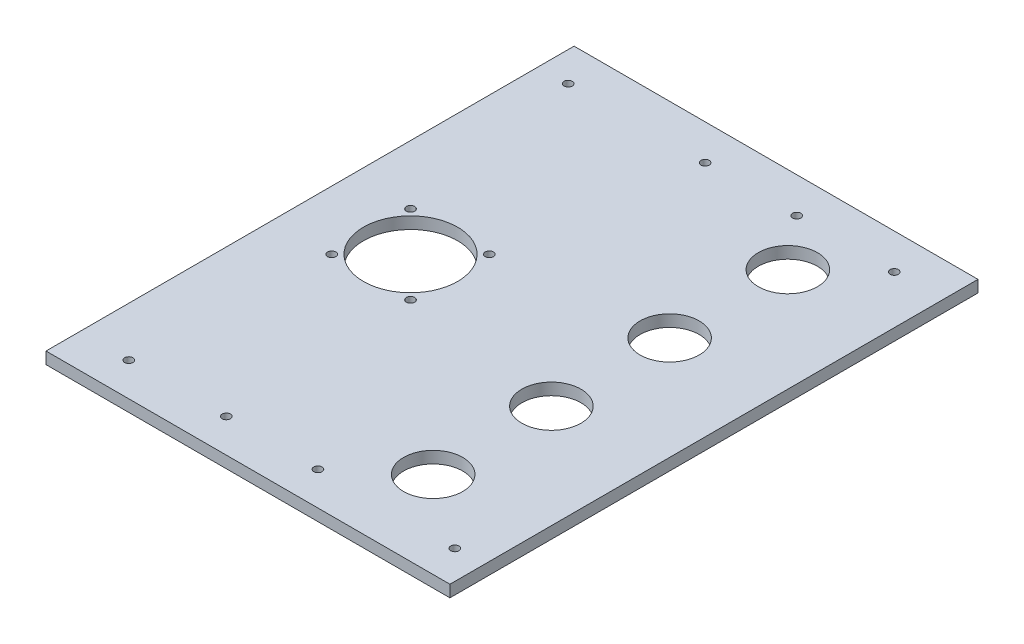
from build123d import *

# Parameters (mm, degrees)
ESBO_O1_W                    = 205
ESBO_O1_H                    = 268
RESSALTO_EXTRUS_O1_DEPTH     = 6
ESBO_O3_R                    = 23.9
ESBO_O3_R_2                  = 2.1
CORTE_EXTRUS_O4_DEPTH        = 169.814247029
ESBO_O4_R                    = 15
CORTE_EXTRUS_O5_DEPTH        = 169.814247029
FURO_DE_DI_METRO_4_2_4_2_1_D = 4.2


with BuildPart() as part:
    # Esboço1 → Ressalto-extrusão1 (new body)
    with BuildSketch(Plane.XZ):
        Rectangle(ESBO_O1_W, ESBO_O1_H)
    extrude(amount=-RESSALTO_EXTRUS_O1_DEPTH)

    # Esboço3 → Corte-extrusão4 (cut, through all)
    with BuildSketch(Plane(origin=(0, 6, 0), x_dir=(1, 0, 0), z_dir=(0, 1, 0))):
        with Locations(Location((-52.5, 1, 0), (0, 0, 270))):
            Circle(ESBO_O3_R)
        with Locations(Location((-72.5, 21, 0), (0, 0, 270))):
            Circle(ESBO_O3_R_2)
        with Locations(Location((-32.5, 21, 0), (0, 0, 270))):
            Circle(ESBO_O3_R_2)
        with Locations(Location((-32.5, -19, 0), (0, 0, 270))):
            Circle(ESBO_O3_R_2)
        with Locations(Location((-72.5, -19, 0), (0, 0, 270))):
            Circle(ESBO_O3_R_2)
    extrude(amount=-CORTE_EXTRUS_O4_DEPTH, mode=Mode.SUBTRACT)

    # Esboço4 → Corte-extrusão5 (cut, through all)
    with BuildSketch(Plane(origin=(0, 6, 0), x_dir=(1, 0, 0), z_dir=(0, 1, 0))):
        with Locations(Location((50, 30, 0), (0, 0, 270))):
            Circle(ESBO_O4_R)
        with Locations(Location((50, -30, 0), (0, 0, 270))):
            Circle(ESBO_O4_R)
        with Locations(Location((50, 90, 0), (0, 0, 270))):
            Circle(ESBO_O4_R)
        with Locations(Location((50, -90, 0), (0, 0, 270))):
            Circle(ESBO_O4_R)
    extrude(amount=-CORTE_EXTRUS_O5_DEPTH, mode=Mode.SUBTRACT)

    # Furo de diâmetro Ø4.2 (4.2)1 (through all)
    with Locations(Plane(origin=(0, 6, 0), x_dir=(1, 0, 0), z_dir=(0, 1, 0))):
        with Locations((-87.5, 116), (-18, 116), (28.5, 116), (78, 116), (-77.5, -117), (-28, -117), (18.5, -117), (88, -117)):
            Hole(FURO_DE_DI_METRO_4_2_4_2_1_D / 2)


solid = part.part
